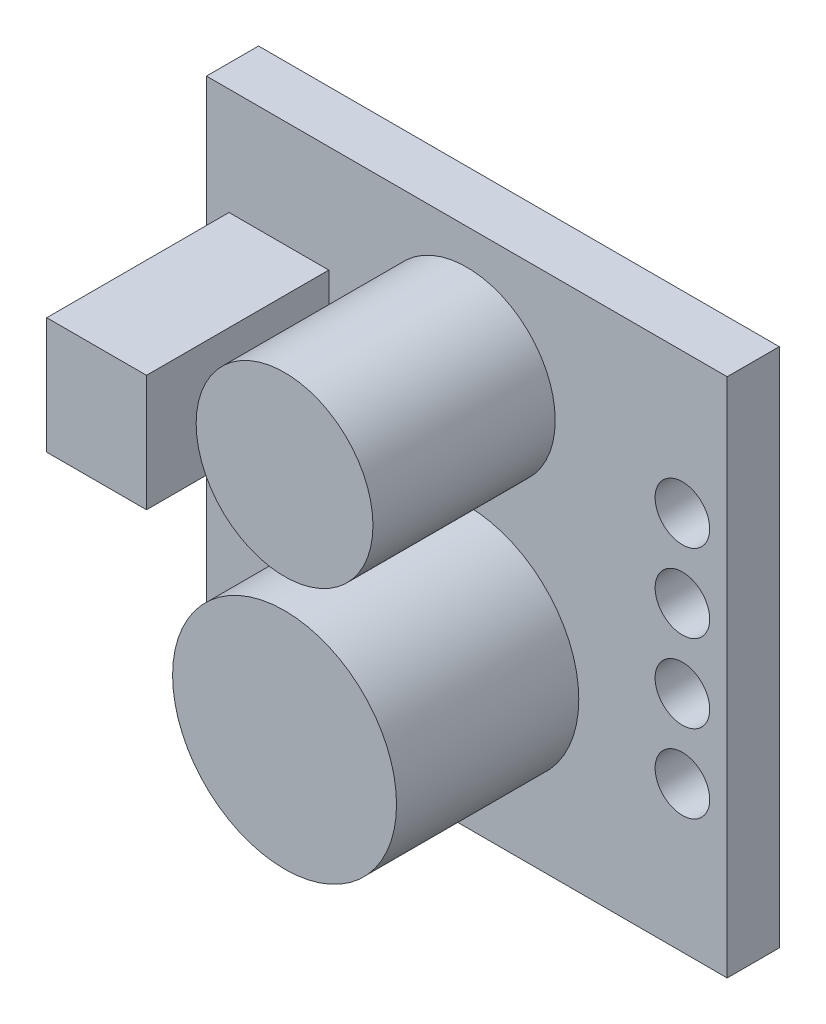
from build123d import *

# Parameters (mm, degrees)
CROQUIS1_W              = 20
CROQUIS1_H              = 20
SALIENTE_EXTRUIR1_DEPTH = 2
CROQUIS2_R              = 3.395302969
CROQUIS2_R_2            = 4.300626918
CROQUIS2_W              = 3.832057349
CROQUIS2_H              = 4.474113334
SALIENTE_EXTRUIR2_DEPTH = 7
CROQUIS3_R              = 1.048920166
CORTAR_EXTRUIR1_DEPTH   = 2


with BuildPart() as part:
    # Croquis1 → Saliente-Extruir1 (new body)
    with BuildSketch(Plane.XY):
        Rectangle(CROQUIS1_W, CROQUIS1_H)
    extrude(amount=SALIENTE_EXTRUIR1_DEPTH)

    # Croquis2 → Saliente-Extruir2 (add)
    with BuildSketch(Plane.XY.offset(2)):
        with Locations(Location((0, 5.24700562, 0), (0, 0, 180))):
            Circle(CROQUIS2_R)
        with Locations(Location((0, -3.577988987, 0), (0, 0, 180))):
            Circle(CROQUIS2_R_2)
        with Locations((-7.217868445, 3.658804494)):
            Rectangle(CROQUIS2_W, CROQUIS2_H)
    extrude(amount=SALIENTE_EXTRUIR2_DEPTH)

    # Croquis3 → Cortar-Extruir1 (cut)
    with BuildSketch(Plane.XY.offset(2)):
        with Locations((8.280127459, 4.598002093)):
            Circle(CROQUIS3_R)
        with Locations((8.280127459, 1.598002093)):
            Circle(CROQUIS3_R)
        with Locations((8.280127459, -1.401997907)):
            Circle(CROQUIS3_R)
        with Locations((8.280127459, -4.401997907)):
            Circle(CROQUIS3_R)
    extrude(amount=-CORTAR_EXTRUIR1_DEPTH, mode=Mode.SUBTRACT)


solid = part.part
